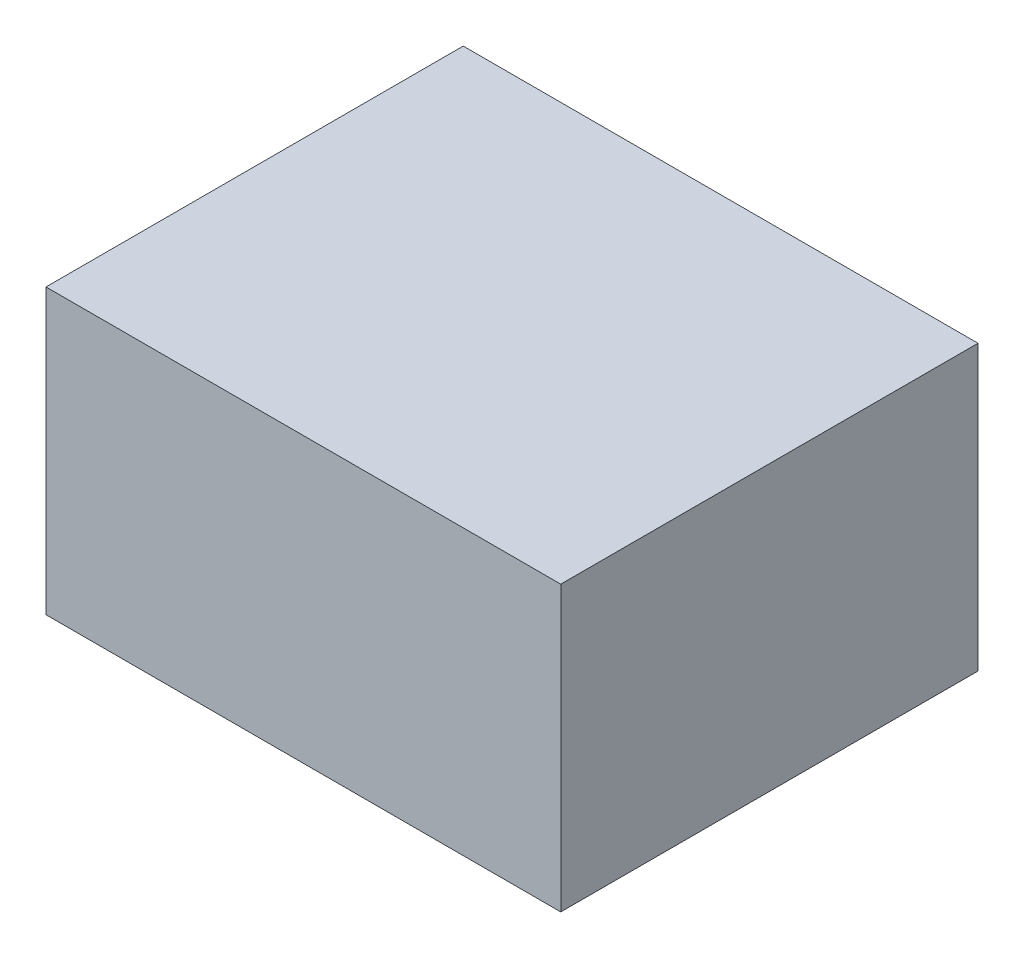
from build123d import *

# Parameters (mm, degrees)
SKETCH1_W           = 345.44
SKETCH1_H           = 280
BOSS_EXTRUDE1_DEPTH = 190.5


with BuildPart() as part:
    # Sketch1 → Boss-Extrude1 (new body)
    with BuildSketch(Plane(origin=(0, 0, 0), x_dir=(1, 0, 0), z_dir=(0, 1, 0))):
        Rectangle(SKETCH1_W, SKETCH1_H)
    extrude(amount=BOSS_EXTRUDE1_DEPTH)


solid = part.part
